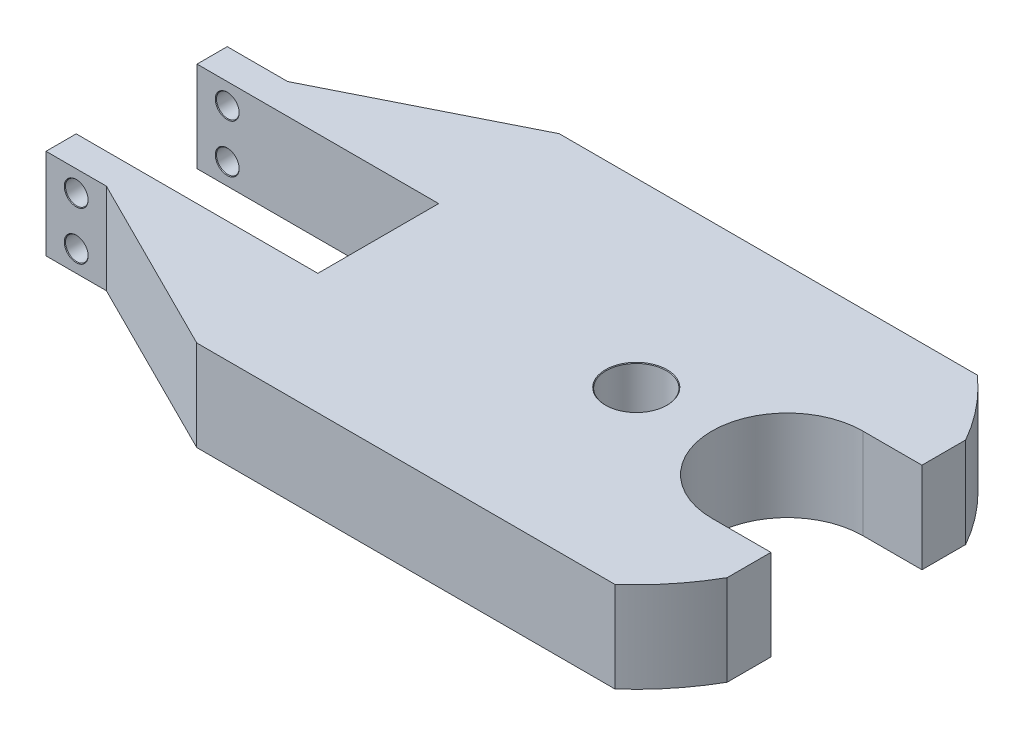
from build123d import *

# Parameters (mm, degrees)
SKETCH2_R           = 12.7
BOSS_EXTRUDE1_DEPTH = 38.1
SKETCH4_R           = 9.525
CUT_EXTRUDE1_DEPTH  = 19.05
SKETCH5_R           = 4.7625
CUT_EXTRUDE2_DEPTH  = 231.794329436
CHAMFER1_SIZE       = 0.254


with BuildPart() as part:
    # Sketch2 → Boss-Extrude1 (new body)
    with BuildSketch(Plane(origin=(0, 0, 0), x_dir=(1, 0, 0), z_dir=(0, 1, 0))):
        with BuildLine():
            Line((0, -25.4), (0, 25.4))
            Line((0, 25.4), (-101.6, 25.4))
            Line((-101.6, 25.4), (-101.6, 38.1))
            Line((-101.6, 38.1), (-76.2, 38.1))
            Line((-76.2, 38.1), (-0.116505732, 76.2))
            Line((-0.116505732, 76.2), (175.688681182, 76.2))
            ThreePointArc((175.688681182, 76.2), (187.352798222, 64.052185316), (196.85, 50.144482907))
            Line((196.85, 50.144482907), (196.85, 31.75))
            Line((196.85, 31.75), (171.986597881, 31.75))
            ThreePointArc((171.986597881, 31.75), (140.236597881, 0), (171.986597881, -31.75))
            Line((171.986597881, -31.75), (196.85, -31.75))
            Line((196.85, -31.75), (196.85, -50.144482907))
            ThreePointArc((196.85, -50.144482907), (187.352798222, -64.052185316), (175.688681182, -76.2))
            Line((175.688681182, -76.2), (-0.116505732, -76.2))
            Line((-0.116505732, -76.2), (-76.2, -38.1))
            Line((-76.2, -38.1), (-101.6, -38.1))
            Line((-101.6, -38.1), (-101.6, -25.4))
            Line((-101.6, -25.4), (0, -25.4))
        make_face()
        with Locations(Location((108.486597881, 0, 0), (0, 0, 90))):
            Circle(SKETCH2_R, mode=Mode.SUBTRACT)
    extrude(amount=BOSS_EXTRUDE1_DEPTH)

    # Sketch4 → Cut-Extrude1 (cut)
    with BuildSketch(Plane.ZY):
        with Locations((0, 19.05)):
            Circle(SKETCH4_R)
    extrude(amount=-CUT_EXTRUDE1_DEPTH, mode=Mode.SUBTRACT)

    # Sketch5 → Cut-Extrude2 (cut, through all)
    with BuildSketch(Plane.XY.offset(38.1)):
        with Locations((-88.9, 29.21)):
            Circle(SKETCH5_R)
        with Locations((-88.9, 8.89)):
            Circle(SKETCH5_R)
    extrude(amount=-CUT_EXTRUDE2_DEPTH, mode=Mode.SUBTRACT)

    # Chamfer1
    chamfer1_edges = [part.edges().sort_by_distance(p)[0] for p in [
        (108.486597881, 0, 12.7),
        (108.486597881, 38.1, 12.7),
        (0, 19.05, -9.525),
        (-93.6625, 29.21, -38.1),
        (-93.6625, 29.21, -25.4),
        (-93.6625, 29.21, 38.1),
        (-93.6625, 8.89, -38.1),
        (-93.6625, 8.89, -25.4),
        (-93.6625, 8.89, 25.4),
        (-93.6625, 8.89, 38.1),
    ]]
    chamfer(chamfer1_edges, length=CHAMFER1_SIZE)


solid = part.part
